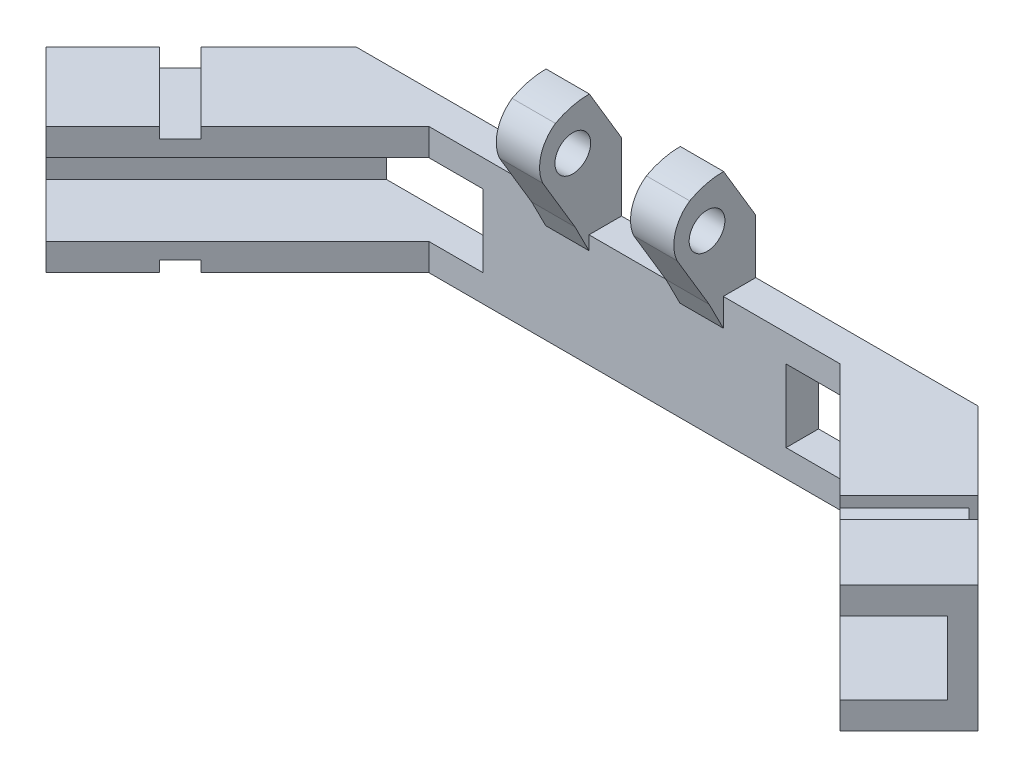
from build123d import *

# Parameters (mm, degrees)
CROQUIS1_W              = 88
CROQUIS1_H              = 11.7
SALIENTE_EXTRUIR1_DEPTH = 25
CORTAR_EXTRUIR1_DEPTH   = 11.7
CROQUIS4_W              = 7
CROQUIS4_H              = 6.7
CORTAR_EXTRUIR2_DEPTH   = 30
CROQUIS5_W              = 7
CROQUIS5_H              = 6.7
CORTAR_EXTRUIR3_DEPTH   = 30
CROQUIS6_W              = 5
CROQUIS6_H              = 6.7
CORTAR_EXTRUIR4_DEPTH   = 3
CROQUIS7_W              = 2.7
CROQUIS7_H              = 1
CORTAR_EXTRUIR5_DEPTH   = 30
CORTAR_EXTRUIR6_DEPTH   = 30
CROQUIS10_W             = 2.7
CROQUIS10_H             = 1
CORTAR_EXTRUIR7_DEPTH   = 30
CORTAR_EXTRUIR8_DEPTH   = 30
CROQUIS12_W             = 4
CROQUIS12_H             = 8.5
SALIENTE_EXTRUIR2_DEPTH = 10
CORTAR_EXTRUIR9_START   = -16.4
CROQUIS13_R             = 1.65
CORTAR_EXTRUIR9_DEPTH   = 16.4
CORTAR_EXTRUIR10_DEPTH  = 20
CROQUIS15_W             = 4
CROQUIS15_H             = 5.789985178
SALIENTE_EXTRUIR3_DEPTH = 1.292749
CORTAR_EXTRUIR11_START  = -16.4
CORTAR_EXTRUIR11_DEPTH  = 16.4
CROQUIS17_W             = 8.4
CROQUIS17_H             = 1.271995795
CORTAR_EXTRUIR12_DEPTH  = 20


with BuildPart() as part:
    # Croquis1 → Saliente-Extruir1 (new body)
    with BuildSketch(Plane.XY):
        with Locations((-35.700934579, 16.869626168)):
            Rectangle(CROQUIS1_W, CROQUIS1_H)
    extrude(amount=SALIENTE_EXTRUIR1_DEPTH)

    # Croquis3 → Cortar-Extruir1 (cut)
    with BuildSketch(Plane.XZ.offset(-11.019626168)):
        Polygon((-16.700934579, 3), (0.97673495, 20.67766953), (7.340695981, 14.313708499), (-6.973012518, 0), (8.299065421, 0), (8.299065421, 25), (-79.700934579, 25), (-79.700934579, 0), (-64.428856641, 0), (-78.74256514, 14.313708499), (-72.378604109, 20.67766953), (-54.700934579, 3), align=None)
    extrude(amount=-CORTAR_EXTRUIR1_DEPTH, mode=Mode.SUBTRACT)

    # Croquis4 → Cortar-Extruir2 (cut)
    with BuildSketch(Plane(origin=(-46.528136819, 0, 46.528136819), x_dir=(0.707106781186546, 0, 0.707106781186549), z_dir=(-0.707106781186549, 0, 0.707106781186546))):
        with Locations((-40.058081435, 16.869626168)):
            Rectangle(CROQUIS4_W, CROQUIS4_H)
    extrude(amount=-CORTAR_EXTRUIR2_DEPTH, mode=Mode.SUBTRACT)

    # Croquis5 → Cortar-Extruir3 (cut)
    with BuildSketch(Plane(origin=(10.82720224, 0, 10.82720224), x_dir=(0.7071067811865477, 0, -0.7071067811865475), z_dir=(0.7071067811865475, 0, 0.7071067811865477))):
        with Locations((-10.430664437, 16.869626168)):
            Rectangle(CROQUIS5_W, CROQUIS5_H)
    extrude(amount=-CORTAR_EXTRUIR3_DEPTH, mode=Mode.SUBTRACT)

    # Croquis6 → Cortar-Extruir4 (cut)
    with BuildSketch(Plane.XY.offset(3)):
        with Locations((-52.200934579, 16.869626168)):
            Rectangle(CROQUIS6_W, CROQUIS6_H)
        with Locations((-19.200934579, 16.869626168)):
            Rectangle(CROQUIS6_W, CROQUIS6_H)
    extrude(amount=-CORTAR_EXTRUIR4_DEPTH, mode=Mode.SUBTRACT)

    # Croquis7 → Cortar-Extruir5 (cut)
    with BuildSketch(Plane(origin=(-3.486506259, 0, 3.486506259), x_dir=(-0.7071067811865472, 0, -0.7071067811865479), z_dir=(0.7071067811865479, 0, -0.7071067811865472))):
        with Locations((-6.540655907, 11.519626168)):
            Rectangle(CROQUIS7_W, CROQUIS7_H)
        with Locations((-6.540655907, 22.219626168)):
            Rectangle(CROQUIS7_W, CROQUIS7_H)
    extrude(amount=-CORTAR_EXTRUIR5_DEPTH, mode=Mode.SUBTRACT)

    # Croquis9 → Cortar-Extruir6 (cut)
    with BuildSketch(Plane.XZ.offset(-12.019626168)):
        Polygon((0.183841731, 7.156854249), (2.093030041, 9.066042559), (1.672230345, 9.486842254), (-0.236957964, 7.577653945), align=None)
    extrude(amount=-CORTAR_EXTRUIR6_DEPTH, mode=Mode.SUBTRACT)

    # Croquis10 → Cortar-Extruir7 (cut)
    with BuildSketch(Plane(origin=(-32.21442832, 0, -32.21442832), x_dir=(-0.707106781186549, 0, 0.707106781186546), z_dir=(-0.707106781186546, 0, -0.707106781186549))):
        with Locations((57.029401778, 22.219626168)):
            Rectangle(CROQUIS10_W, CROQUIS10_H)
        with Locations((57.029401778, 11.519626168)):
            Rectangle(CROQUIS10_W, CROQUIS10_H)
    extrude(amount=-CORTAR_EXTRUIR7_DEPTH, mode=Mode.SUBTRACT)

    # Croquis11 → Cortar-Extruir8 (cut)
    with BuildSketch(Plane.XZ.offset(-12.019626168)):
        Polygon((-71.58571089, 7.156854249), (-70.878604109, 7.863961031), (-72.787792418, 9.77314934), (-73.494899199, 9.066042559), align=None)
    extrude(amount=-CORTAR_EXTRUIR8_DEPTH, mode=Mode.SUBTRACT)

    # Croquis12 → Saliente-Extruir2 (add)
    with BuildSketch(Plane(origin=(0, 22.719626168, 0), x_dir=(1, 0, 0), z_dir=(0, 1, 0))):
        with Locations((-29.500934579, -4.25)):
            Rectangle(CROQUIS12_W, CROQUIS12_H)
        with Locations((-41.900934579, -4.25)):
            Rectangle(CROQUIS12_W, CROQUIS12_H)
    extrude(amount=SALIENTE_EXTRUIR2_DEPTH)

    # Croquis13 → Cortar-Extruir9 (cut)
    with BuildSketch(Plane(origin=(-27.500934579, 0, 0), x_dir=(0, 0, -1), z_dir=(1, 0, 0)).offset(CORTAR_EXTRUIR9_START)):
        with Locations((-4.5, 28.719626168)):
            Circle(CROQUIS13_R)
        with BuildLine():
            Line((0, 27.719626168), (-2.971466884, 32.699888422))
            ThreePointArc((-2.971466884, 32.699888422), (-6.100596854, 31.91119471), (-8.46936188, 29.719746698))
            Line((-8.46936188, 29.719746698), (-4.292749227, 22.719626168))
            Line((-4.292749227, 22.719626168), (-8.5, 22.719626168))
            Line((-8.5, 22.719626168), (-8.5, 32.719626168))
            Line((-8.5, 32.719626168), (0, 32.719626168))
            Line((0, 32.719626168), (0, 27.719626168))
        make_face()
    extrude(amount=CORTAR_EXTRUIR9_DEPTH, mode=Mode.SUBTRACT)

    # Croquis14 → Cortar-Extruir10 (cut)
    with BuildSketch(Plane(origin=(-27.500934579, 0, 0), x_dir=(0, 0, -1), z_dir=(1, 0, 0))):
        with BuildLine():
            Line((-8.46936188, 29.719746698), (-7.269222305, 27.708278944))
            ThreePointArc((-7.269222305, 27.708278944), (-7.44017574, 30.019739431), (-6.100596854, 31.91119471))
            Line((-6.100596854, 31.91119471), (-7.548349231, 31.815598295))
            Line((-7.548349231, 31.815598295), (-8.46936188, 29.719746698))
        make_face()
    extrude(amount=-CORTAR_EXTRUIR10_DEPTH, mode=Mode.SUBTRACT)

    # Croquis15 → Saliente-Extruir3 (add)
    with BuildSketch(Plane.XY.offset(3)):
        with Locations((-41.900934579, 19.824633579)):
            Rectangle(CROQUIS15_W, CROQUIS15_H)
        with Locations((-29.500934579, 19.824633579)):
            Rectangle(CROQUIS15_W, CROQUIS15_H)
    extrude(amount=SALIENTE_EXTRUIR3_DEPTH)

    # Croquis16 → Cortar-Extruir11 (cut)
    with BuildSketch(Plane.ZY.offset(43.900934579).offset(CORTAR_EXTRUIR11_START)):
        Polygon((4.292749227, 22.719626168), (3, 20.175634578), (3, 16.92964099), (4.292749227, 16.92964099), align=None)
    extrude(amount=CORTAR_EXTRUIR11_DEPTH, mode=Mode.SUBTRACT)

    # Croquis17 → Cortar-Extruir12 (cut)
    with BuildSketch(Plane.XY.offset(3)):
        with Locations((-35.700934579, 22.083628271)):
            Rectangle(CROQUIS17_W, CROQUIS17_H)
    extrude(amount=-CORTAR_EXTRUIR12_DEPTH, mode=Mode.SUBTRACT)


solid = part.part
